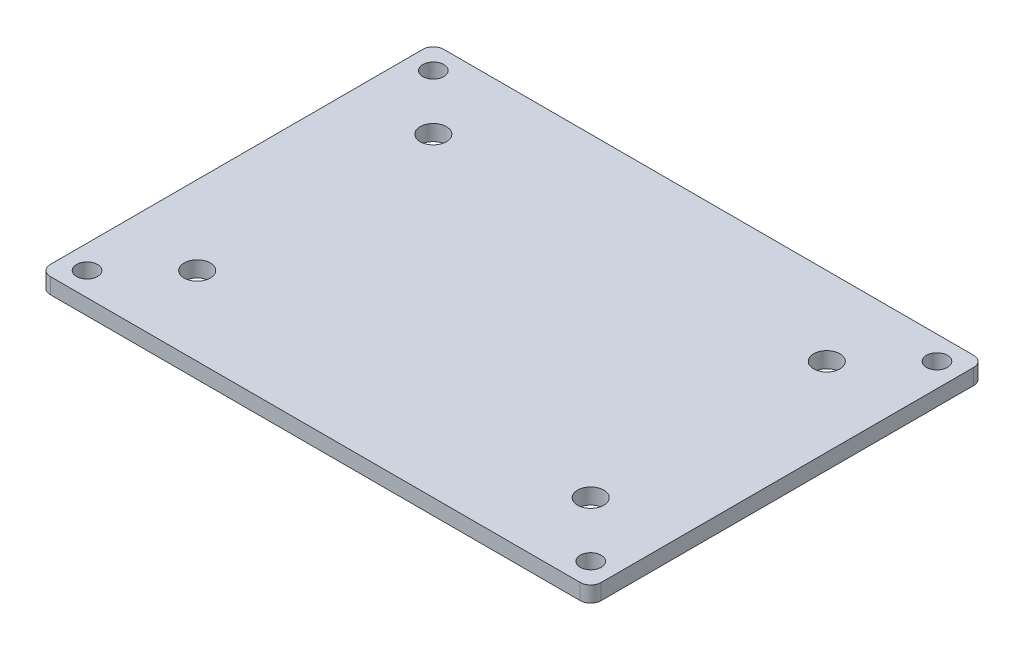
from build123d import *

# Parameters (mm, degrees)
SKETCH_1_W          = 105
SKETCH_1_H          = 75
SKETCH_1_R          = 2
EXTRUDE_1_DEPTH     = 3
FILLET_1_R          = 2
SKETCH_2_R          = 2.5
CUT_EXTRUDE_1_DEPTH = 10


with BuildPart() as part:
    # 스케치1 → 보스-돌출1 (new body)
    with BuildSketch(Plane(origin=(0, 0, 0), x_dir=(1, 0, 0), z_dir=(0, 1, 0))):
        Rectangle(SKETCH_1_W, SKETCH_1_H)
        with Locations(Location((-48, 33, 0), (0, 0, 270))):
            Circle(SKETCH_1_R, mode=Mode.SUBTRACT)
        with Locations(Location((-48, -33, 0), (0, 0, 270))):
            Circle(SKETCH_1_R, mode=Mode.SUBTRACT)
        with Locations(Location((48, -33, 0), (0, 0, 270))):
            Circle(SKETCH_1_R, mode=Mode.SUBTRACT)
        with Locations(Location((48, 33, 0), (0, 0, 270))):
            Circle(SKETCH_1_R, mode=Mode.SUBTRACT)
    extrude(amount=EXTRUDE_1_DEPTH)

    # 필렛1
    fillet_1_edges = [part.edges().sort_by_distance(p)[0] for p in [
        (52.5, 1.5, 37.5),
        (-52.5, 1.5, 37.5),
        (-52.5, 1.5, -37.5),
        (52.5, 1.5, -37.5),
    ]]
    fillet(fillet_1_edges, radius=FILLET_1_R)

    # 스케치2 → 컷-돌출1 (cut)
    with BuildSketch(Plane(origin=(0, 3, 0), x_dir=(1, 0, 0), z_dir=(0, 1, 0))):
        with Locations(Location((-37.5, -22.5, 0), (0, 0, 270))):
            Circle(SKETCH_2_R)
        with Locations(Location((37.5, -22.5, 0), (0, 0, 270))):
            Circle(SKETCH_2_R)
        with Locations(Location((37.5, 22.5, 0), (0, 0, 270))):
            Circle(SKETCH_2_R)
        with Locations(Location((-37.5, 22.5, 0), (0, 0, 270))):
            Circle(SKETCH_2_R)
    extrude(amount=-CUT_EXTRUDE_1_DEPTH, mode=Mode.SUBTRACT)


solid = part.part
